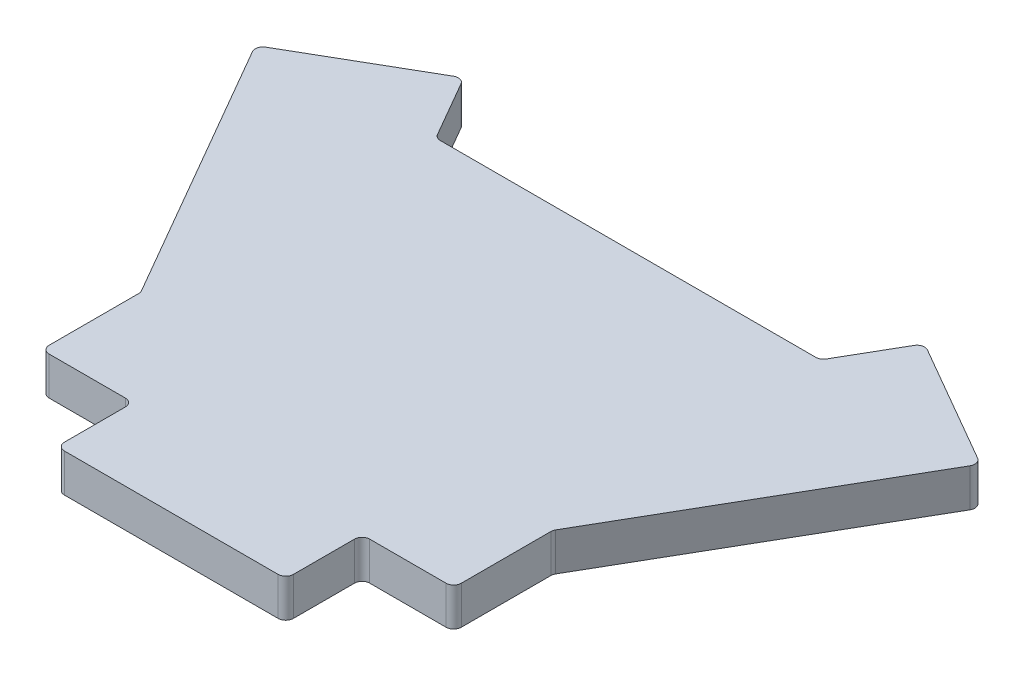
from build123d import *

# Parameters (mm, degrees)
EXTRUDE_1_DEPTH = 5
FILLET_1_R      = 1


with BuildPart() as part:
    # 草圖1 → 填料-伸長1 (new body)
    with BuildSketch(Plane(origin=(0, 0, 0), x_dir=(1, 0, 0), z_dir=(0, 1, 0))):
        Polygon((15, 0), (-15, 0), (-15, 10), (-27, 10), (-27, 23), (-47.5, 58.507041555), (-30.179491924, 68.507041555), (-25.179491924, 59.846787517), (25.179491924, 59.846787517), (30.179491924, 68.507041555), (47.5, 58.507041555), (27, 23), (27, 10), (15, 10), align=None)
    extrude(amount=EXTRUDE_1_DEPTH)

    # 圓角1
    fillet_1_edges = [part.edges().sort_by_distance(p)[0] for p in [
        (-27, 2.5, -10),
        (-27, 2.5, -23),
        (-47.5, 2.5, -58.507041555),
        (-30.179491924, 2.5, -68.507041555),
        (-25.179491924, 2.5, -59.846787517),
        (25.179491924, 2.5, -59.846787517),
        (30.179491924, 2.5, -68.507041555),
        (47.5, 2.5, -58.507041555),
        (27, 2.5, -23),
        (27, 2.5, -10),
        (15, 2.5, -10),
        (15, 2.5, 0),
        (-15, 2.5, 0),
        (-15, 2.5, -10),
    ]]
    fillet(fillet_1_edges, radius=FILLET_1_R)


solid = part.part
